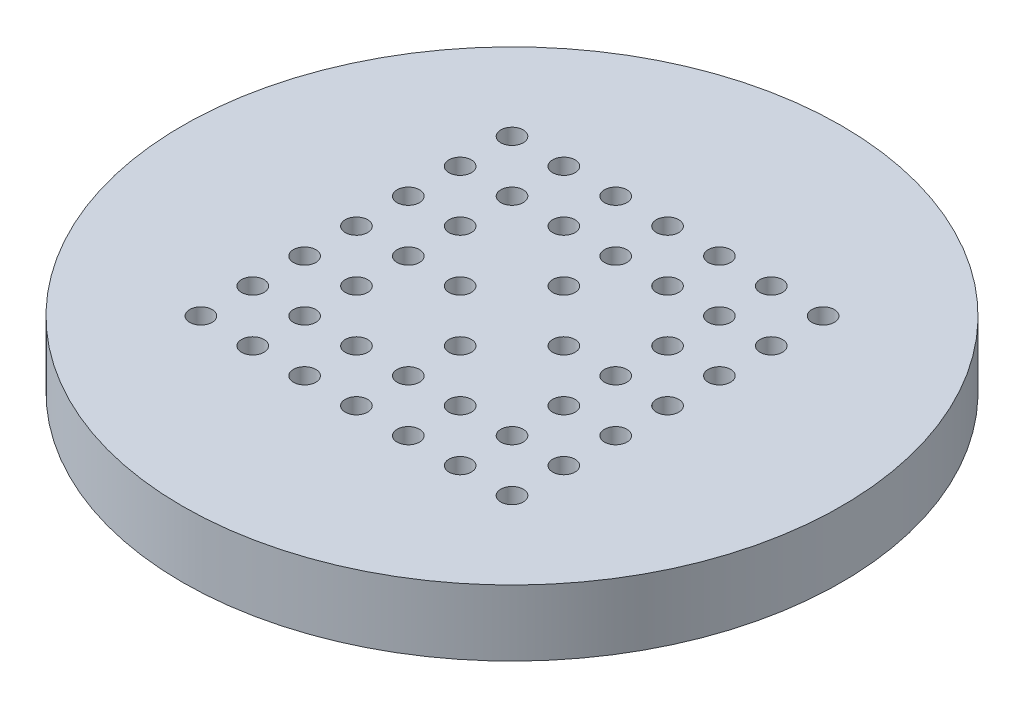
from build123d import *

# Parameters (mm, degrees)
SKETCH1_R                                 = 19.05
BILLET_DEPTH                              = 3.81
SKETCH2_R                                 = 0.6477
FIRST_LOX_HOLE_DEPTH                      = 28.208842313
BRAISING_CHAMFER_SIZE                     = 0.254
LOX_HOLE_PATTERN_COUNT                    = 7
LOX_HOLE_PATTERN_PITCH                    = 2.9972
LOX_HOLE_PATTERN_COUNT_DIR2               = 7
LOX_HOLE_PATTERN_PITCH_DIR2               = 2.9972
BRAISING_CHAMFER_OF_LOX_HOLE_PATTERN_SIZE = 0.254


with BuildPart() as part:
    # Sketch1 → Billet (new body)
    with BuildSketch(Plane(origin=(0, 0, 0), x_dir=(1, 0, 0), z_dir=(0, 1, 0))):
        Circle(SKETCH1_R)
    extrude(amount=-BILLET_DEPTH)

    # Sketch2 → First Lox Hole (cut, symmetric)
    with BuildSketch(Plane(origin=(0, 0, 0), x_dir=(1, 0, 0), z_dir=(0, 1, 0))):
        with Locations((8.9916, 8.9916)):
            Circle(SKETCH2_R)
    first_lox_hole = extrude(amount=FIRST_LOX_HOLE_DEPTH, both=True, mode=Mode.SUBTRACT)

    # Braising Chamfer
    braising_chamfer_edges = [part.edges().sort_by_distance(p)[0] for p in [
        (8.3439, -3.81, -8.9916),
    ]]
    chamfer(braising_chamfer_edges, length=BRAISING_CHAMFER_SIZE)

    # Lox Hole Pattern: First Lox Hole 7 × 7, 5 skipped
    with Locations(*[(-i * LOX_HOLE_PATTERN_PITCH, 0, j * LOX_HOLE_PATTERN_PITCH_DIR2) for i in range(LOX_HOLE_PATTERN_COUNT) for j in range(LOX_HOLE_PATTERN_COUNT_DIR2) if (i, j) not in ((0, 0), (2, 2), (2, 4), (3, 3), (4, 2), (4, 4))]):
        add(first_lox_hole, mode=Mode.SUBTRACT)

    # Braising Chamfer of Lox Hole Pattern
    braising_chamfer_of_lox_hole_pattern_edges = [part.edges().sort_by_distance(p)[0] for p in [
        (8.3439, -3.81, -5.9944),
        (8.3439, -3.81, -2.9972),
        (8.3439, -3.81, 0),
        (8.3439, -3.81, 2.9972),
        (8.3439, -3.81, 5.9944),
        (8.3439, -3.81, 8.9916),
        (5.3467, -3.81, -8.9916),
        (5.3467, -3.81, -5.9944),
        (5.3467, -3.81, -2.9972),
        (5.3467, -3.81, 0),
        (5.3467, -3.81, 2.9972),
        (5.3467, -3.81, 5.9944),
        (5.3467, -3.81, 8.9916),
        (2.3495, -3.81, -8.9916),
        (2.3495, -3.81, -5.9944),
        (2.3495, -3.81, 0),
        (2.3495, -3.81, 5.9944),
        (2.3495, -3.81, 8.9916),
        (-0.6477, -3.81, -8.9916),
        (-0.6477, -3.81, -5.9944),
        (-0.6477, -3.81, -2.9972),
        (-0.6477, -3.81, 2.9972),
        (-0.6477, -3.81, 5.9944),
        (-0.6477, -3.81, 8.9916),
        (-3.6449, -3.81, -8.9916),
        (-3.6449, -3.81, -5.9944),
        (-3.6449, -3.81, 0),
        (-3.6449, -3.81, 5.9944),
        (-3.6449, -3.81, 8.9916),
        (-6.6421, -3.81, -8.9916),
        (-6.6421, -3.81, -5.9944),
        (-6.6421, -3.81, -2.9972),
        (-6.6421, -3.81, 0),
        (-6.6421, -3.81, 2.9972),
        (-6.6421, -3.81, 5.9944),
        (-6.6421, -3.81, 8.9916),
        (-9.6393, -3.81, -8.9916),
        (-9.6393, -3.81, -5.9944),
        (-9.6393, -3.81, -2.9972),
        (-9.6393, -3.81, 0),
        (-9.6393, -3.81, 2.9972),
        (-9.6393, -3.81, 5.9944),
        (-9.6393, -3.81, 8.9916),
    ]]
    chamfer(braising_chamfer_of_lox_hole_pattern_edges, length=BRAISING_CHAMFER_OF_LOX_HOLE_PATTERN_SIZE)


solid = part.part
